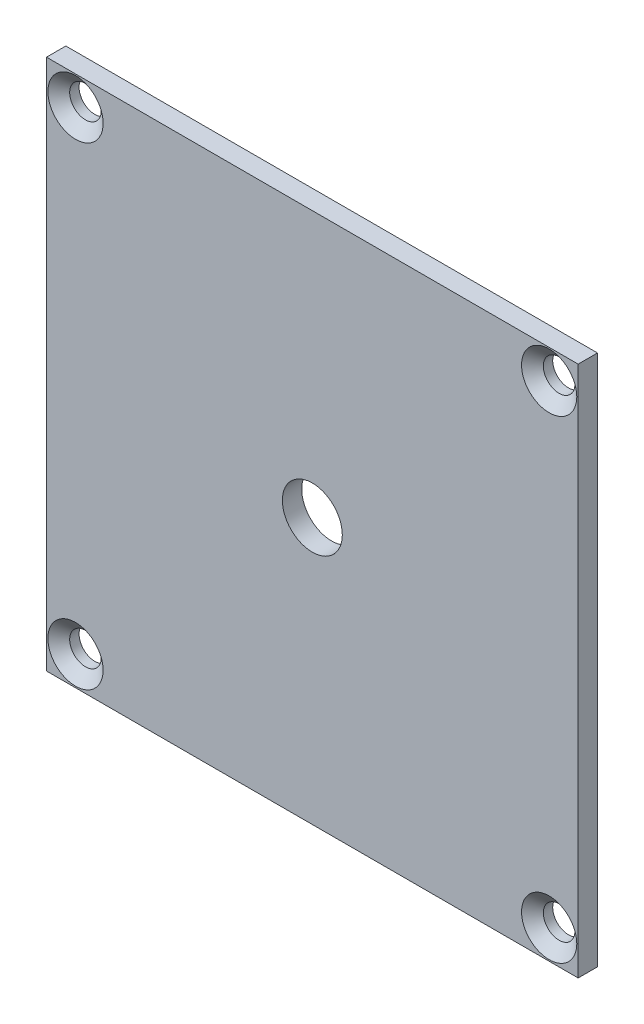
from build123d import *

# Parameters (mm, degrees)
SKETCH1_W                                 = 55
SKETCH1_H                                 = 55
BOSS_EXTRUDE1_DEPTH                       = 2
SKETCH3_R                                 = 3.1
CUT_EXTRUDE1_DEPTH                        = 78.807454656
CSK_FOR_4_FLAT_HEAD_MACHINE_SCREW_2_COUNT = 2
CSK_FOR_4_FLAT_HEAD_MACHINE_SCREW_2_PITCH = 49
CSK_FOR_4_FLAT_HEAD_MACHINE_SCREW_3_COUNT = 2
CSK_FOR_4_FLAT_HEAD_MACHINE_SCREW_3_PITCH = 69.296464556
CSK_FOR_4_FLAT_HEAD_MACHINE_SCREW_4_COUNT = 2
CSK_FOR_4_FLAT_HEAD_MACHINE_SCREW_4_PITCH = 49


with BuildPart() as part:
    # Sketch1 → Boss-Extrude1 (new body)
    with BuildSketch(Plane.XY):
        with Locations((27.5, 27.5)):
            Rectangle(SKETCH1_W, SKETCH1_H)
    extrude(amount=BOSS_EXTRUDE1_DEPTH)

    # Sketch3 → Cut-Extrude1 (cut, through all)
    with BuildSketch(Plane.XY.offset(2)):
        with Locations((27.5, 27.5)):
            Circle(SKETCH3_R)
    extrude(amount=-CUT_EXTRUDE1_DEPTH, mode=Mode.SUBTRACT)

    # Sketch5 → CSK for #4 Flat Head Machine Screw (100)1 (revolve, cut)
    with BuildSketch(Plane(origin=(3, 52, 2), x_dir=(0, -1, 0), z_dir=(1, 0, 0))):
        Polygon((0, 0), (0, 2), (1.63195, 2), (1.63195, 1.028358553), (2.8575, 0), align=None)
    csk_for_4_flat_head_machine_screw_100 = revolve(axis=Axis((3, 52, 8.35), (0, 0, -1)), mode=Mode.SUBTRACT)

    # CSK for _4 Flat Head Machine Screw _ 2: CSK for #4 Flat Head Machine Screw (100)1 ×2
    with Locations(*[(i * CSK_FOR_4_FLAT_HEAD_MACHINE_SCREW_2_PITCH, 0, 0) for i in range(1, CSK_FOR_4_FLAT_HEAD_MACHINE_SCREW_2_COUNT)]):
        add(csk_for_4_flat_head_machine_screw_100, mode=Mode.SUBTRACT)

    # CSK for _4 Flat Head Machine Screw _ 3: CSK for #4 Flat Head Machine Screw (100)1 ×2
    with Locations(*[Vector(0.7071067811865477, -0.7071067811865475, 0) * (i * CSK_FOR_4_FLAT_HEAD_MACHINE_SCREW_3_PITCH) for i in range(1, CSK_FOR_4_FLAT_HEAD_MACHINE_SCREW_3_COUNT)]):
        add(csk_for_4_flat_head_machine_screw_100, mode=Mode.SUBTRACT)

    # CSK for _4 Flat Head Machine Screw _ 4: CSK for #4 Flat Head Machine Screw (100)1 ×2
    with Locations(*[(0, -i * CSK_FOR_4_FLAT_HEAD_MACHINE_SCREW_4_PITCH, 0) for i in range(1, CSK_FOR_4_FLAT_HEAD_MACHINE_SCREW_4_COUNT)]):
        add(csk_for_4_flat_head_machine_screw_100, mode=Mode.SUBTRACT)


solid = part.part
